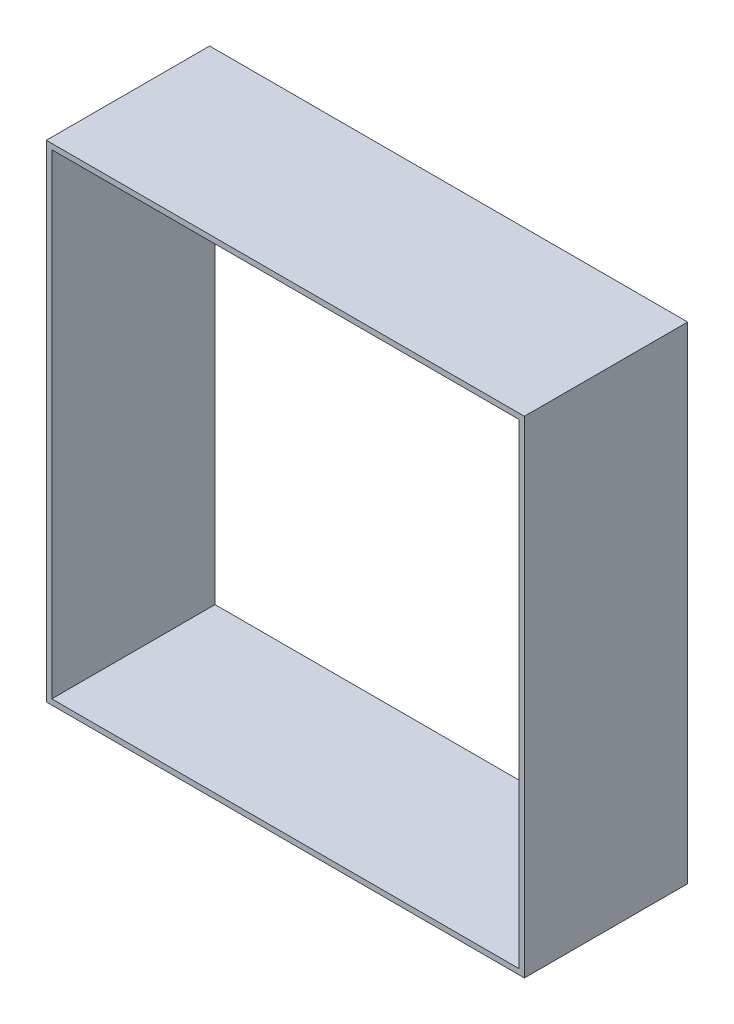
from build123d import *

# Parameters (mm, degrees)
SKETCH1_W           = 87.85
SKETCH1_H           = 89.4
SKETCH1_W_2         = 85.85
SKETCH1_H_2         = 87.4
BOSS_EXTRUDE1_DEPTH = 15


with BuildPart() as part:
    # Sketch1 → Boss-Extrude1 (new, symmetric)
    with BuildSketch(Plane.XY):
        Rectangle(SKETCH1_W, SKETCH1_H)
        Rectangle(SKETCH1_W_2, SKETCH1_H_2, mode=Mode.SUBTRACT)
    extrude(amount=BOSS_EXTRUDE1_DEPTH, both=True)


solid = part.part
